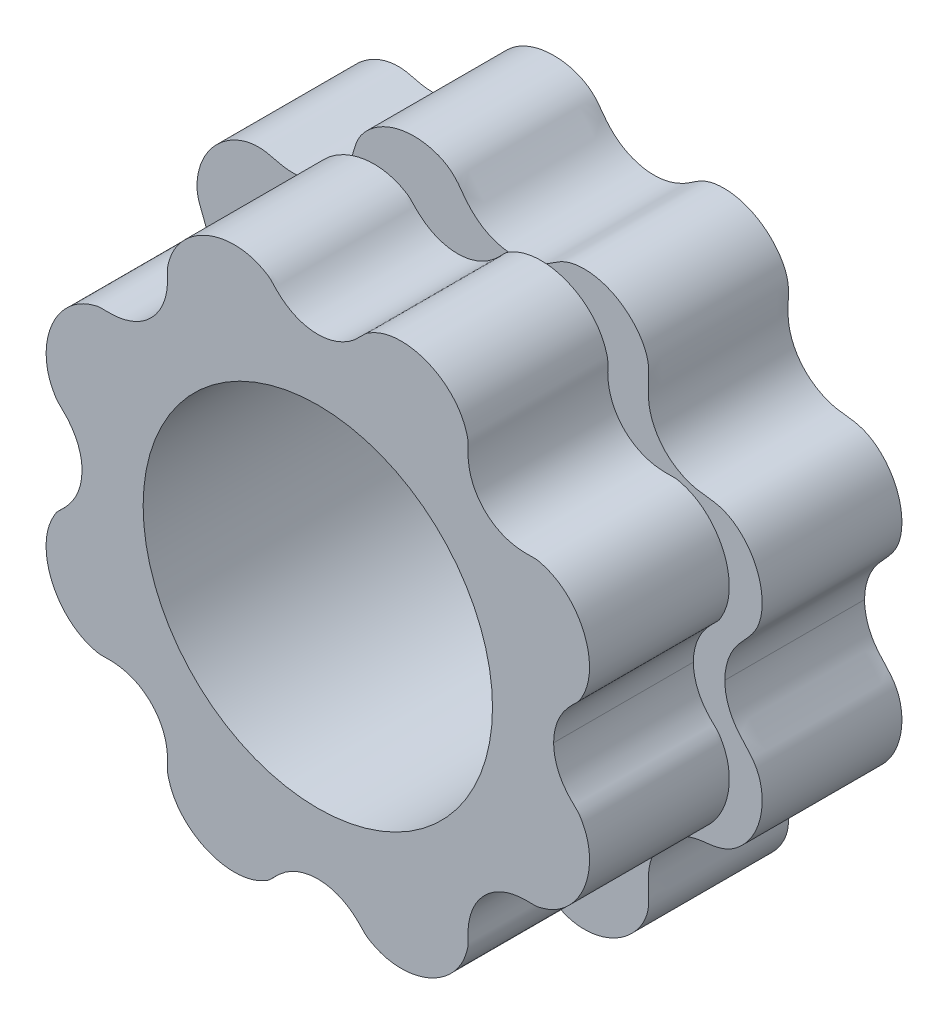
from build123d import *

# Parameters (mm, degrees)
BOSS_EXTRU_4_DEPTH      = 4
BOSS_EXTRU_5_DEPTH      = 4
ESQUISSE4_R             = 5
ENL_V_MAT_EXTRU_1_DEPTH = 16.147639189


with BuildPart() as part:
    # Esquisse1 → Boss.-Extru.4 (new body)
    with BuildSketch(Plane.XY):
        with BuildLine():
            add(Edge.make_bspline(
                [(7.65, 0), (7.65, 0.340806275), (7.809832637, 0.86986378), (8.297272463, 1.364642586), (8.671749197, 1.828030626), (8.783100225, 2.637649337), (8.530543161, 3.388779471), (8.140665171, 3.875630806), (7.762693, 4.1564655), (7.338291975, 4.287217022), (6.658898677, 4.318091071), (5.858435691, 4.75755249), (5.452973057, 5.566633338), (5.457248732, 6.269289598), (5.504683015, 6.879027111), (5.106669474, 7.587518159), (4.453338995, 8.036022547), (3.848016595, 8.191414773), (3.379369766, 8.189777535), (2.945901637, 8.058414665), (2.561755631, 7.75380191), (2.078259034, 7.542411794), (1.383002265, 7.462286483), (0.701116152, 7.705351487), (0.211382918, 8.211279407), (-0.129230721, 8.750229279), (-0.855193433, 9.077334897), (-1.651122631, 9.042360631), (-2.228637289, 8.801969348), (-2.601660996, 8.52150577), (-2.886564133, 8.15658521), (-2.993911927, 7.700569277), (-3.191280842, 7.211168704), (-3.638840629, 6.672834579), (-4.29855466, 6.377265415), (-5.001629961, 6.397084317), (-5.47664752, 6.553313269), (-5.924957522, 6.551220473), (-6.519984406, 6.355263353), (-7.008869524, 5.946325313), (-7.325824676, 5.406639393), (-7.457137864, 4.959616695), (-7.471844797, 4.490109756), (-7.301055166, 4.073881725), (-7.100079355, 3.588202089), (-7.065820228, 3.064721758), (-7.184058844, 2.552198363), (-7.453911319, 2.101633055), (-7.841381277, 1.746143577), (-8.314063384, 1.537309226), (-8.681850356, 1.289833072), (-9.041497219, 0.776058476), (-9.15, 0.306988491), (-9.15, 0)],
                knots=[0.066092855, 0.066092855, 0.066092855, 0.066092855, 0.093239718, 0.106813149, 0.12038658, 0.147533443, 0.174680306, 0.188253737, 0.201827168, 0.2154006, 0.228974031, 0.256120894, 0.283267756, 0.296841188, 0.310414619, 0.337561482, 0.364708344, 0.378281776, 0.391855207, 0.405428638, 0.41900207, 0.432575501, 0.446148932, 0.473295795, 0.486869226, 0.500442658, 0.52758952, 0.554736383, 0.568309814, 0.581883246, 0.595456677, 0.609030108, 0.622603539, 0.636176971, 0.663323833, 0.676897265, 0.690470696, 0.704044127, 0.717617559, 0.744764421, 0.758337853, 0.771911284, 0.785484715, 0.799058147, 0.812631578, 0.826205009, 0.839778441, 0.853351872, 0.866925303, 0.880498735, 0.894072166, 0.907645597, 0.93479246, 0.93479246, 0.93479246, 0.93479246], degree=3))
            add(Edge.make_bspline(
                [(-9.15, 0), (-9.15, -0.306988491), (-9.041497219, -0.776058476), (-8.681850356, -1.289833072), (-8.314063384, -1.537309226), (-7.841381277, -1.746143577), (-7.453911319, -2.101633055), (-7.184058844, -2.552198363), (-7.065820228, -3.064721758), (-7.100079355, -3.588202089), (-7.301055166, -4.073881725), (-7.471844797, -4.490109756), (-7.457137864, -4.959616695), (-7.325824676, -5.406639393), (-7.008869524, -5.946325313), (-6.519984406, -6.355263353), (-5.924957522, -6.551220473), (-5.47664752, -6.553313269), (-5.001629961, -6.397084317), (-4.29855466, -6.377265415), (-3.638840629, -6.672834579), (-3.191280842, -7.211168704), (-2.993911927, -7.700569277), (-2.886564133, -8.15658521), (-2.601660996, -8.52150577), (-2.228637289, -8.801969348), (-1.651122631, -9.042360631), (-0.855193433, -9.077334897), (-0.129230721, -8.750229279), (0.211382918, -8.211279407), (0.701116152, -7.705351487), (1.383002265, -7.462286483), (2.078259034, -7.542411794), (2.561755631, -7.75380191), (2.945901637, -8.058414665), (3.379369766, -8.189777535), (3.848016595, -8.191414773), (4.453338995, -8.036022547), (5.106669474, -7.587518159), (5.504683015, -6.879027111), (5.457248732, -6.269289598), (5.452973057, -5.566633338), (5.858435691, -4.75755249), (6.658898677, -4.318091071), (7.338291975, -4.287217022), (7.762693, -4.1564655), (8.140665171, -3.875630806), (8.530543161, -3.388779471), (8.783100225, -2.637649337), (8.671749197, -1.828030626), (8.297272463, -1.364642586), (7.809832637, -0.86986378), (7.65, -0.340806275), (7.65, 0)],
                knots=[0.066092855, 0.066092855, 0.066092855, 0.066092855, 0.093239718, 0.106813149, 0.12038658, 0.133960012, 0.147533443, 0.161106874, 0.174680306, 0.188253737, 0.201827168, 0.2154006, 0.228974031, 0.242547462, 0.256120894, 0.283267756, 0.296841188, 0.310414619, 0.32398805, 0.337561482, 0.364708344, 0.378281776, 0.391855207, 0.405428638, 0.41900207, 0.432575501, 0.446148932, 0.473295795, 0.500442658, 0.514016089, 0.52758952, 0.554736383, 0.568309814, 0.581883246, 0.595456677, 0.609030108, 0.622603539, 0.636176971, 0.663323833, 0.690470696, 0.704044127, 0.717617559, 0.744764421, 0.771911284, 0.785484715, 0.799058147, 0.812631578, 0.826205009, 0.853351872, 0.880498735, 0.894072166, 0.907645597, 0.93479246, 0.93479246, 0.93479246, 0.93479246], degree=3))
        make_face()
    extrude(amount=BOSS_EXTRU_4_DEPTH)

    # Esquisse3 → Boss.-Extru.5 (add)
    with BuildSketch(Plane.XY.offset(4)):
        with BuildLine():
            add(Edge.make_bspline(
                [(6.75, 0), (6.75, -0.020333329), (6.750911698, -0.060721165), (6.755013704, -0.146255053), (6.765934234, -0.228756848), (6.782292242, -0.325231551), (6.804097093, -0.414117971), (6.831246035, -0.504990216), (6.863773528, -0.592876788), (6.920603102, -0.723920739), (7.013863719, -0.890915093), (7.12889532, -1.04609533), (7.262722697, -1.185839686), (7.368004548, -1.286798915), (7.440603484, -1.353880861), (7.505592929, -1.433732158), (7.555866008, -1.528008547), (7.621606358, -1.650069739), (7.694666629, -1.82582778), (7.756787162, -2.055388817), (7.796586219, -2.436162884), (7.745406193, -2.854449457), (7.597550164, -3.267704282), (7.360299728, -3.634284715), (7.129202117, -3.882528983), (6.911029266, -4.047720637), (6.729442768, -4.148632783), (6.582910839, -4.210991898), (6.477611559, -4.24659022), (6.371472594, -4.278634709), (6.262754437, -4.304262475), (6.150855369, -4.300867999), (6.040390565, -4.29846812), (5.92388811, -4.297828416), (5.802558165, -4.304110793), (5.643615155, -4.322345988), (5.422949827, -4.370506731), (5.155012199, -4.474174653), (4.865397, -4.663930867), (4.641857025, -4.900394662), (4.494367658, -5.133675347), (4.392240014, -5.366482474), (4.327234891, -5.593443389), (4.299303676, -5.805317296), (4.297173393, -5.996342528), (4.301329225, -6.160282795), (4.305167239, -6.282595483), (4.267733233, -6.405103659), (4.230172327, -6.530982162), (4.188480889, -6.63800339), (4.120016285, -6.784521691), (4.011110905, -6.963663193), (3.787029161, -7.23907353), (3.451926236, -7.499517606), (3.050173989, -7.6875521), (2.619908244, -7.776399773), (2.317740655, -7.7846307), (2.076004582, -7.755356156), (1.904328348, -7.714835976), (1.78053718, -7.67422098), (1.667879653, -7.628640444), (1.567868752, -7.57733905), (1.46538823, -7.524008207), (1.366897152, -7.456983696), (1.285679219, -7.36531844), (1.198679309, -7.27700844), (1.109731936, -7.189941254), (1.015034234, -7.110158534), (0.915892924, -7.036295606), (0.811784621, -6.970231069), (0.646310508, -6.881295), (0.409977498, -6.790938348), (0.102563585, -6.734882081), (-0.222925876, -6.752750083), (-0.48796223, -6.819528909), (-0.719152748, -6.915399395), (-0.890743882, -7.01501109), (-1.042884303, -7.129119766), (-1.181950441, -7.258747348), (-1.278704418, -7.358308345), (-1.362608045, -7.452111487), (-1.458920626, -7.519645486), (-1.548576128, -7.566986411), (-1.643582051, -7.617345032), (-1.748531623, -7.661936338), (-1.904393542, -7.716714957), (-2.115895996, -7.765320161), (-2.480805892, -7.796360904), (-2.905233447, -7.733007392), (-3.313045513, -7.5745839), (-3.665633285, -7.333844325), (-3.897383812, -7.111079339), (-4.068733124, -6.880327096), (-4.174372707, -6.680487497), (-4.237341251, -6.510750638), (-4.27423521, -6.383876536), (-4.300329348, -6.285489835), (-4.3024906, -6.187454548), (-4.299633566, -6.094070283), (-4.297637857, -5.989401246), (-4.299515451, -5.873798168), (-4.311616939, -5.713106583), (-4.343378824, -5.533624569), (-4.39885972, -5.349490276), (-4.499606195, -5.124814123), (-4.648072253, -4.892566367), (-4.842571365, -4.688966406), (-5.076382286, -4.525662921), (-5.315970926, -4.410694687), (-5.543125068, -4.338314177), (-5.756640915, -4.303852122), (-5.94974172, -4.296939133), (-6.099223598, -4.299327752), (-6.205347856, -4.30409652), (-6.314284704, -4.295654882), (-6.421257978, -4.262867182), (-6.55803044, -4.221973892), (-6.739085993, -4.146725591), (-6.952020341, -4.022797199), (-7.187834175, -3.827004594), (-7.406540103, -3.570934424), (-7.583765228, -3.273194872), (-7.711120574, -2.940806182), (-7.776388716, -2.607355505), (-7.784990848, -2.284017206), (-7.744133012, -1.996342678), (-7.677497426, -1.776474279), (-7.600528263, -1.60848175), (-7.534046918, -1.486924274), (-7.477838839, -1.392215033), (-7.399457891, -1.316194757), (-7.322172205, -1.242845661), (-7.241491236, -1.163757735), (-7.16123733, -1.076658429), (-7.082619644, -0.980278416), (-7.008067459, -0.873710191), (-6.946991429, -0.770583668), (-6.897959427, -0.672600242), (-6.859179177, -0.581187604), (-6.828979432, -0.497396532), (-6.803180086, -0.411116563), (-6.782074799, -0.322593745), (-6.765931531, -0.231342471), (-6.755015359, -0.142298941), (-6.750911689, -0.061906599), (-6.75, -0.020333329), (-6.75, 0)],
                knots=[0.062817882, 0.062817882, 0.062817882, 0.062817882, 0.062817882, 0.065749889, 0.068681895, 0.071613902, 0.074545909, 0.077511447, 0.080476984, 0.083442522, 0.08640806, 0.095482745, 0.104557429, 0.107666816, 0.110776202, 0.113885588, 0.116994974, 0.12059222, 0.124189465, 0.131383957, 0.140924897, 0.150465837, 0.172222379, 0.183937221, 0.195652063, 0.205212055, 0.214772046, 0.218272315, 0.221772584, 0.225272853, 0.228773122, 0.232271056, 0.235768991, 0.239266925, 0.24276486, 0.246927457, 0.251090054, 0.259415248, 0.271178783, 0.282913714, 0.294344438, 0.300072465, 0.305800493, 0.314900573, 0.324000653, 0.326912543, 0.329824432, 0.33564821, 0.339255622, 0.342863034, 0.346470446, 0.350077858, 0.359645647, 0.369213436, 0.391031388, 0.402991225, 0.414951062, 0.424282034, 0.428947519, 0.433613005, 0.437156741, 0.440700477, 0.444244213, 0.447787949, 0.451711436, 0.455634922, 0.459558408, 0.463481894, 0.467364723, 0.471247551, 0.475130379, 0.479013207, 0.49103032, 0.503005702, 0.514153833, 0.519741091, 0.525328349, 0.534497339, 0.539081834, 0.543666329, 0.549255311, 0.552049802, 0.554844292, 0.558433171, 0.562022049, 0.565610927, 0.569199805, 0.579249975, 0.589300144, 0.611552986, 0.622679661, 0.633806336, 0.642851562, 0.651896788, 0.658762002, 0.662194609, 0.665627217, 0.668578046, 0.671528875, 0.674479704, 0.677430533, 0.681767493, 0.686104452, 0.694778371, 0.70035703, 0.705935689, 0.717086289, 0.729367768, 0.73552704, 0.741686313, 0.750505432, 0.759324551, 0.762669958, 0.766015366, 0.769360773, 0.77270618, 0.776375756, 0.780045332, 0.787384483, 0.797351183, 0.807317883, 0.818483505, 0.829649127, 0.840814543, 0.851979959, 0.861108245, 0.870236531, 0.877295664, 0.880825231, 0.884354798, 0.88772753, 0.891100262, 0.894472995, 0.897845727, 0.901942084, 0.906038442, 0.910134799, 0.914231157, 0.91703689, 0.919842624, 0.922648358, 0.925454091, 0.928386098, 0.931318105, 0.934250111, 0.937182118, 0.937182118, 0.937182118, 0.937182118, 0.937182118], degree=4))
            add(Edge.make_bspline(
                [(6.75, 0), (6.75, 0.020333329), (6.750911698, 0.060721165), (6.755013704, 0.146255053), (6.765934234, 0.228756848), (6.782292242, 0.325231551), (6.804097093, 0.41411797), (6.831246035, 0.504990216), (6.863773528, 0.592876788), (6.920603102, 0.723920739), (7.013863719, 0.890915093), (7.12889532, 1.04609533), (7.262722697, 1.185839686), (7.368004548, 1.286798915), (7.440603484, 1.353880861), (7.505592929, 1.433732158), (7.555866008, 1.528008547), (7.621606358, 1.650069739), (7.69466663, 1.82582778), (7.756787162, 2.055388817), (7.796586219, 2.436162884), (7.745406193, 2.854449457), (7.597550164, 3.267704282), (7.360299728, 3.634284715), (7.129202117, 3.882528983), (6.911029266, 4.047720637), (6.729442768, 4.148632783), (6.582910839, 4.210991898), (6.477611559, 4.24659022), (6.371472594, 4.278634709), (6.262754437, 4.304262475), (6.150855369, 4.300867999), (6.040390565, 4.29846812), (5.92388811, 4.297828416), (5.802558165, 4.304110793), (5.643615155, 4.322345988), (5.422949827, 4.37050673), (5.155012199, 4.474174653), (4.865397, 4.663930867), (4.641857025, 4.900394662), (4.494367658, 5.133675347), (4.392240014, 5.366482474), (4.327234891, 5.593443389), (4.299303676, 5.805317296), (4.297173393, 5.996342528), (4.301329225, 6.160282795), (4.305167239, 6.282595483), (4.267733233, 6.405103659), (4.230172327, 6.530982162), (4.188480889, 6.63800339), (4.120016285, 6.784521691), (4.011110906, 6.963663193), (3.787029161, 7.23907353), (3.451926236, 7.499517606), (3.05017399, 7.6875521), (2.619908245, 7.776399773), (2.317740656, 7.7846307), (2.076004582, 7.755356156), (1.904328348, 7.714835976), (1.780537181, 7.67422098), (1.667879653, 7.628640444), (1.567868752, 7.57733905), (1.46538823, 7.524008207), (1.366897152, 7.456983696), (1.285679219, 7.36531844), (1.19867931, 7.27700844), (1.109731936, 7.189941254), (1.015034234, 7.110158534), (0.915892924, 7.036295606), (0.811784621, 6.970231069), (0.646310508, 6.881295), (0.409977498, 6.790938348), (0.102563585, 6.734882081), (-0.222925876, 6.752750083), (-0.48796223, 6.819528909), (-0.719152748, 6.915399395), (-0.890743882, 7.01501109), (-1.042884303, 7.129119766), (-1.181950441, 7.258747348), (-1.278704418, 7.358308345), (-1.362608045, 7.452111487), (-1.458920626, 7.519645486), (-1.548576128, 7.566986411), (-1.643582051, 7.617345032), (-1.748531623, 7.661936338), (-1.904393542, 7.716714957), (-2.115895996, 7.765320161), (-2.480805891, 7.796360904), (-2.905233447, 7.733007392), (-3.313045513, 7.5745839), (-3.665633284, 7.333844326), (-3.897383812, 7.111079339), (-4.068733124, 6.880327096), (-4.174372707, 6.680487497), (-4.237341251, 6.510750638), (-4.27423521, 6.383876536), (-4.300329347, 6.285489835), (-4.3024906, 6.187454548), (-4.299633566, 6.094070283), (-4.297637857, 5.989401246), (-4.299515451, 5.873798168), (-4.311616939, 5.713106583), (-4.343378824, 5.53362457), (-4.39885972, 5.349490276), (-4.499606195, 5.124814124), (-4.648072253, 4.892566368), (-4.842571365, 4.688966406), (-5.076382286, 4.525662921), (-5.315970926, 4.410694687), (-5.543125068, 4.338314177), (-5.756640915, 4.303852122), (-5.94974172, 4.296939133), (-6.099223597, 4.299327752), (-6.205347856, 4.30409652), (-6.314284704, 4.295654882), (-6.421257978, 4.262867182), (-6.55803044, 4.221973892), (-6.739085993, 4.146725591), (-6.952020341, 4.022797199), (-7.187834175, 3.827004594), (-7.406540103, 3.570934424), (-7.583765228, 3.273194872), (-7.711120574, 2.940806182), (-7.776388716, 2.607355505), (-7.784990848, 2.284017206), (-7.744133012, 1.996342678), (-7.677497426, 1.776474279), (-7.600528263, 1.60848175), (-7.534046918, 1.486924274), (-7.477838839, 1.392215033), (-7.399457891, 1.316194757), (-7.322172205, 1.242845661), (-7.241491236, 1.163757735), (-7.16123733, 1.076658429), (-7.082619644, 0.980278416), (-7.008067459, 0.873710192), (-6.946991429, 0.770583668), (-6.897959427, 0.672600242), (-6.859179177, 0.581187605), (-6.828979432, 0.497396532), (-6.803180086, 0.411116563), (-6.782074799, 0.322593745), (-6.765931531, 0.231342471), (-6.755015359, 0.142298941), (-6.750911689, 0.061906599), (-6.75, 0.020333329), (-6.75, 0)],
                knots=[0.062817882, 0.062817882, 0.062817882, 0.062817882, 0.062817882, 0.065749889, 0.068681895, 0.071613902, 0.074545909, 0.077511447, 0.080476984, 0.083442522, 0.08640806, 0.095482745, 0.104557429, 0.107666816, 0.110776202, 0.113885588, 0.116994974, 0.12059222, 0.124189465, 0.131383957, 0.140924897, 0.150465837, 0.172222379, 0.183937221, 0.195652063, 0.205212055, 0.214772046, 0.218272315, 0.221772584, 0.225272853, 0.228773122, 0.232271056, 0.235768991, 0.239266925, 0.24276486, 0.246927457, 0.251090054, 0.259415248, 0.271178783, 0.282913714, 0.294344438, 0.300072465, 0.305800493, 0.314900573, 0.324000653, 0.326912543, 0.329824432, 0.33564821, 0.339255622, 0.342863034, 0.346470446, 0.350077858, 0.359645647, 0.369213436, 0.391031388, 0.402991225, 0.414951062, 0.424282034, 0.428947519, 0.433613005, 0.437156741, 0.440700477, 0.444244213, 0.447787949, 0.451711436, 0.455634922, 0.459558408, 0.463481894, 0.467364723, 0.471247551, 0.475130379, 0.479013207, 0.49103032, 0.503005702, 0.514153833, 0.519741091, 0.525328349, 0.534497339, 0.539081834, 0.543666329, 0.549255311, 0.552049802, 0.554844292, 0.558433171, 0.562022049, 0.565610927, 0.569199805, 0.579249975, 0.589300144, 0.611552986, 0.622679661, 0.633806336, 0.642851562, 0.651896788, 0.658762002, 0.662194609, 0.665627217, 0.668578046, 0.671528875, 0.674479704, 0.677430533, 0.681767493, 0.686104452, 0.694778371, 0.70035703, 0.705935689, 0.717086289, 0.729367768, 0.73552704, 0.741686313, 0.750505432, 0.759324551, 0.762669958, 0.766015366, 0.769360773, 0.77270618, 0.776375756, 0.780045332, 0.787384483, 0.797351183, 0.807317883, 0.818483505, 0.829649127, 0.840814543, 0.851979959, 0.861108245, 0.870236531, 0.877295664, 0.880825231, 0.884354798, 0.88772753, 0.891100262, 0.894472995, 0.897845727, 0.901942084, 0.906038442, 0.910134799, 0.914231157, 0.91703689, 0.919842624, 0.922648358, 0.925454091, 0.928386098, 0.931318105, 0.934250111, 0.937182118, 0.937182118, 0.937182118, 0.937182118, 0.937182118], degree=4))
        make_face()
    extrude(amount=BOSS_EXTRU_5_DEPTH)

    # Esquisse4 → Enlèv. mat.-Extru.1 (cut, through all)
    with BuildSketch(Plane(origin=(0, 0, 0), x_dir=(-1, 0, 0), z_dir=(0, 0, -1))):
        Circle(ESQUISSE4_R)
    extrude(amount=-ENL_V_MAT_EXTRU_1_DEPTH, mode=Mode.SUBTRACT)


solid = part.part
